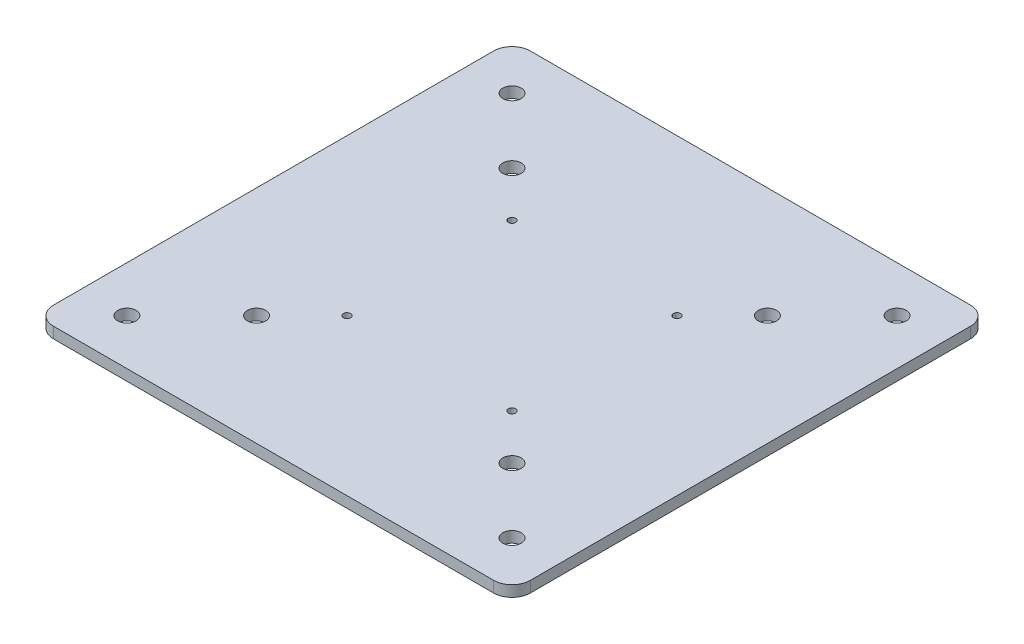
from build123d import *

# Parameters (mm, degrees)
SKETCH1_W           = 130
SKETCH1_H           = 130
SKETCH1_R           = 2.5
SKETCH1_R_2         = 1
BOSS_EXTRUDE1_DEPTH = 3
FILLET1_R           = 5


with BuildPart() as part:
    # Sketch1 → Boss-Extrude1 (new body)
    with BuildSketch(Plane(origin=(0, 0, 0), x_dir=(1, 0, 0), z_dir=(0, 1, 0))):
        Rectangle(SKETCH1_W, SKETCH1_H)
        with Locations(Location((-52.5, 52.5, 0), (0, 0, 270))):
            Circle(SKETCH1_R, mode=Mode.SUBTRACT)
        with Locations(Location((-34.82233047, 34.82233047, 0), (0, 0, 270))):
            Circle(SKETCH1_R, mode=Mode.SUBTRACT)
        with Locations(Location((52.5, 52.5, 0), (0, 0, 270))):
            Circle(SKETCH1_R, mode=Mode.SUBTRACT)
        with Locations(Location((34.82233047, 34.82233047, 0), (0, 0, 270))):
            Circle(SKETCH1_R, mode=Mode.SUBTRACT)
        with Locations(Location((52.5, -52.5, 0), (0, 0, 90))):
            Circle(SKETCH1_R, mode=Mode.SUBTRACT)
        with Locations(Location((34.82233047, -34.82233047, 0), (0, 0, 90))):
            Circle(SKETCH1_R, mode=Mode.SUBTRACT)
        with Locations(Location((-34.82233047, -34.82233047, 0), (0, 0, 90))):
            Circle(SKETCH1_R, mode=Mode.SUBTRACT)
        with Locations(Location((-52.5, -52.5, 0), (0, 0, 90))):
            Circle(SKETCH1_R, mode=Mode.SUBTRACT)
        with Locations(Location((-22.5, 22.5, 0), (0, 0, 270))):
            Circle(SKETCH1_R_2, mode=Mode.SUBTRACT)
        with Locations(Location((22.5, 22.5, 0), (0, 0, 270))):
            Circle(SKETCH1_R_2, mode=Mode.SUBTRACT)
        with Locations(Location((22.5, -22.5, 0), (0, 0, 90))):
            Circle(SKETCH1_R_2, mode=Mode.SUBTRACT)
        with Locations(Location((-22.5, -22.5, 0), (0, 0, 90))):
            Circle(SKETCH1_R_2, mode=Mode.SUBTRACT)
    extrude(amount=BOSS_EXTRUDE1_DEPTH)

    # Fillet1
    fillet1_edges = [part.edges().sort_by_distance(p)[0] for p in [
        (65, 1.5, 65),
        (-65, 1.5, 65),
        (-65, 1.5, -65),
        (65, 1.5, -65),
    ]]
    fillet(fillet1_edges, radius=FILLET1_R)


solid = part.part
